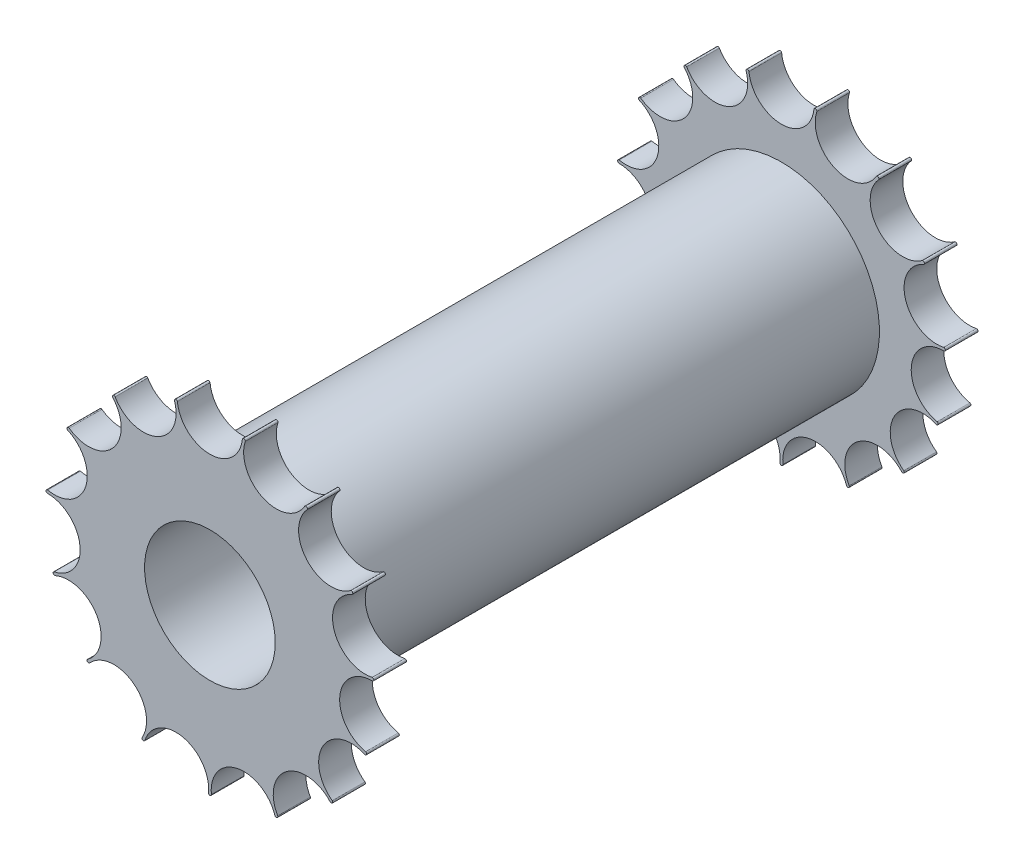
from build123d import *

# Parameters (mm, degrees)
SKETCH1_R               = 10
BOSS_EXTRUDE1_DEPTH     = 37
CUT_EXTRUDE1_DEPTH      = 10
CUT_EXTRUDE1_DEPTH_BACK = 40
SKETCH2_R               = 2
BOSS_EXTRUDE3_DEPTH     = 37
SKETCH4_R               = 4
CUT_EXTRUDE2_DEPTH      = 40
SKETCH6_W               = 33
SKETCH6_H               = 6.863237298


with BuildPart() as part:
    # Sketch1 → Boss-Extrude1 (new body)
    with BuildSketch(Plane.XY):
        Circle(SKETCH1_R)
    extrude(amount=BOSS_EXTRUDE1_DEPTH)

    # Sketch2 → Cut-Extrude1 (cut, two sides: drawn at the far end of the back side and taken through both)
    with BuildSketch(Plane.XY.offset(37).offset(-CUT_EXTRUDE1_DEPTH_BACK)):
        with Locations((0, 10)):
            Circle(SKETCH2_R)
        with Locations((4.067366431, 9.135454576)):
            Circle(SKETCH2_R)
        with Locations((7.431448255, 6.691306064)):
            Circle(SKETCH2_R)
        with Locations((9.510565163, 3.090169944)):
            Circle(SKETCH2_R)
        with Locations((9.945218954, -1.045284633)):
            Circle(SKETCH2_R)
        with Locations((8.660254038, -5)):
            Circle(SKETCH2_R)
        with Locations((5.877852523, -8.090169944)):
            Circle(SKETCH2_R)
        with Locations((2.079116908, -9.781476007)):
            Circle(SKETCH2_R)
        with Locations((-2.079116908, -9.781476007)):
            Circle(SKETCH2_R)
        with Locations((-5.877852523, -8.090169944)):
            Circle(SKETCH2_R)
        with Locations((-8.660254038, -5)):
            Circle(SKETCH2_R)
        with Locations((-9.945218954, -1.045284633)):
            Circle(SKETCH2_R)
        with Locations((-9.510565163, 3.090169944)):
            Circle(SKETCH2_R)
        with Locations((-7.431448255, 6.691306064)):
            Circle(SKETCH2_R)
        with Locations((-4.067366431, 9.135454576)):
            Circle(SKETCH2_R)
    extrude(amount=CUT_EXTRUDE1_DEPTH + CUT_EXTRUDE1_DEPTH_BACK, mode=Mode.SUBTRACT)

    # Sketch3 → Boss-Extrude3 (add)
    with BuildSketch(Plane.XY):
        with BuildLine():
            Line((2.168086595, 9.762141185), (1.989974874, 9.8))
            ThreePointArc((1.989974874, 9.8), (2.097960142, 9.870126453), (2.168086595, 9.762141185))
        make_face()
        with BuildLine():
            Line((5.951266195, 8.036319473), (5.803951609, 8.143349785))
            ThreePointArc((5.803951609, 8.143349785), (5.931124058, 8.163491922), (5.951266195, 8.036319473))
        make_face()
        with BuildLine():
            Line((8.705417805, 4.920945116), (8.614372384, 5.078640412))
            ThreePointArc((8.614372384, 5.078640412), (8.738742742, 5.045315475), (8.705417805, 4.920945116))
        make_face()
        with BuildLine():
            Line((9.95432359, 0.954694644), (9.935289914, 1.135787973))
            ThreePointArc((9.935289914, 1.135787973), (10.035353417, 1.054758147), (9.95432359, 0.954694644))
        make_face()
        with BuildLine():
            Line((9.482036394, -3.176631206), (9.538305559, -3.003452524))
            ThreePointArc((9.538305559, -3.003452524), (9.596760318, -3.118176447), (9.482036394, -3.176631206))
        make_face()
        with BuildLine():
            Line((7.370218964, -6.758688661), (7.49206152, -6.623368794))
            ThreePointArc((7.49206152, -6.623368794), (7.498800176, -6.751950006), (7.370218964, -6.758688661))
        make_face()
        with BuildLine():
            Line((3.984023719, -9.172107446), (4.150371981, -9.098044428))
            ThreePointArc((4.150371981, -9.098044428), (4.104229359, -9.218250068), (3.984023719, -9.172107446))
        make_face()
        with BuildLine():
            Line((-0.091045421, -9.999585528), (0.091045421, -9.999585528))
            ThreePointArc((0.091045421, -9.999585528), (0, -10.090630949), (-0.091045421, -9.999585528))
        make_face()
        with BuildLine():
            Line((-4.150371981, -9.098044428), (-3.984023719, -9.172107446))
            ThreePointArc((-3.984023719, -9.172107446), (-4.104229359, -9.218250068), (-4.150371981, -9.098044428))
        make_face()
        with BuildLine():
            Line((-7.49206152, -6.623368794), (-7.370218964, -6.758688661))
            ThreePointArc((-7.370218964, -6.758688661), (-7.498800176, -6.751950006), (-7.49206152, -6.623368794))
        make_face()
        with BuildLine():
            Line((-9.538305559, -3.003452524), (-9.482036394, -3.176631206))
            ThreePointArc((-9.482036394, -3.176631206), (-9.596760318, -3.118176447), (-9.538305559, -3.003452524))
        make_face()
        with BuildLine():
            Line((-9.935289914, 1.135787973), (-9.95432359, 0.954694644))
            ThreePointArc((-9.95432359, 0.954694644), (-10.035353417, 1.054758147), (-9.935289914, 1.135787973))
        make_face()
        with BuildLine():
            Line((-8.614372384, 5.078640412), (-8.705417805, 4.920945116))
            ThreePointArc((-8.705417805, 4.920945116), (-8.738742742, 5.045315475), (-8.614372384, 5.078640412))
        make_face()
        with BuildLine():
            Line((-5.803951609, 8.143349785), (-5.951266195, 8.036319473))
            ThreePointArc((-5.951266195, 8.036319473), (-5.931124058, 8.163491922), (-5.803951609, 8.143349785))
        make_face()
        with BuildLine():
            Line((-1.989974874, 9.8), (-2.168086595, 9.762141185))
            ThreePointArc((-2.168086595, 9.762141185), (-2.097960142, 9.870126453), (-1.989974874, 9.8))
        make_face()
    extrude(amount=BOSS_EXTRUDE3_DEPTH)

    # Sketch4 → Cut-Extrude2 (cut)
    with BuildSketch(Plane.XY.offset(37)):
        Circle(SKETCH4_R)
    extrude(amount=-CUT_EXTRUDE2_DEPTH, mode=Mode.SUBTRACT)

    # Sketch6 → Cut-Revolve7 (revolve, cut)
    with BuildSketch(Plane(origin=(0, 0, 0), x_dir=(0, 0, -1), z_dir=(1, 0, 0)), mode=Mode.PRIVATE) as cut_revolve7_sk:
        with Locations((-18.5, -9.431204177)):
            Rectangle(SKETCH6_W, SKETCH6_H)
    revolve(cut_revolve7_sk.sketch.rotate(Axis((0, 0, 10.741005804), (0, 0, 1)), 270), axis=Axis((0, 0, 10.741005804), (0, 0, 1)), mode=Mode.SUBTRACT)


solid = part.part
